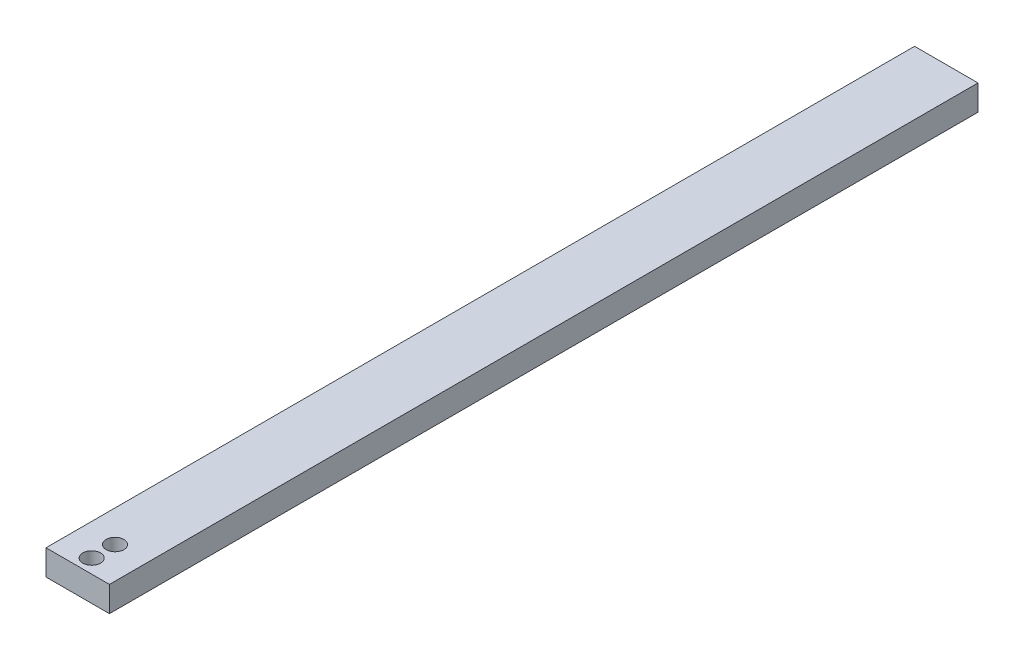
from build123d import *

# Parameters (mm, degrees)
SKETCH2_W               = 50
SKETCH2_H               = 20
BOSS_EXTRUDE1_DEPTH     = 684.5
CUT_EXTRUDE1_DEPTH      = 690.708998128
CUT_EXTRUDE1_DEPTH_BACK = 690.708998128
SKETCH3_R               = 7
SKETCH4_R               = 7
CUT_EXTRUDE2_DEPTH      = 14


with BuildPart() as part:
    # Sketch2 → Boss-Extrude1 (new body)
    with BuildSketch(Plane.XY):
        with Locations((-57.208588957, 18.374233129)):
            Rectangle(SKETCH2_W, SKETCH2_H)
    extrude(amount=BOSS_EXTRUDE1_DEPTH)

    # Sketch3 → Cut-Extrude1 (cut, two sides: drawn at the far end of the back side and taken through both)
    with BuildSketch(Plane(origin=(0, 28.374233129, 0), x_dir=(1, 0, 0), z_dir=(0, 1, 0)).offset(-CUT_EXTRUDE1_DEPTH_BACK)):
        with Locations(Location((-57.208588957, -673.5, 0), (0, 0, 270))):
            Circle(SKETCH3_R)
        with Locations(Location((-57.208588957, -655.1, 0), (0, 0, 270))):
            Circle(SKETCH3_R)
    extrude(amount=CUT_EXTRUDE1_DEPTH + CUT_EXTRUDE1_DEPTH_BACK, mode=Mode.SUBTRACT)

    # Sketch4 → Cut-Extrude2 (cut)
    with BuildSketch(Plane(origin=(0, 0, 0), x_dir=(-1, 0, 0), z_dir=(0, 0, -1))):
        with Locations((57.208588957, 18.374233129)):
            Circle(SKETCH4_R)
    extrude(amount=-CUT_EXTRUDE2_DEPTH, mode=Mode.SUBTRACT)


solid = part.part
